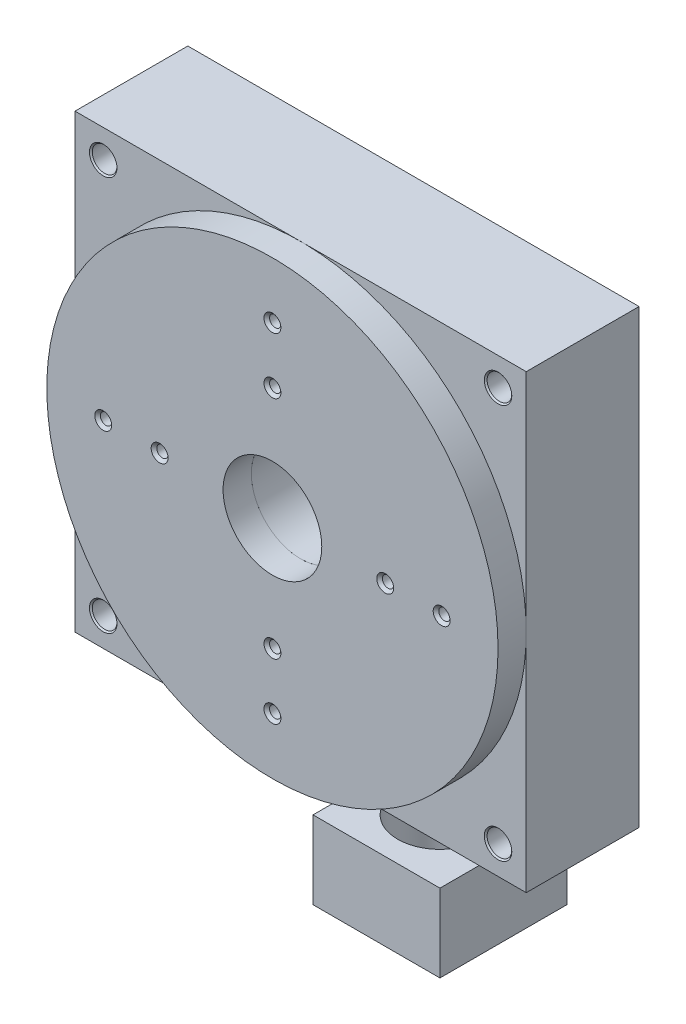
from build123d import *

# Parameters (mm, degrees)
SKETCH1_R                                     = 101.6
SKETCH1_R_2                                   = 22.225
BOSS_EXTRUDE1_DEPTH                           = 12.7
F_1_4_20_TAPPED_HOLE1_AT_2_COUNT              = 2
F_1_4_20_TAPPED_HOLE1_AT_2_PITCH              = 91.581002397
F_1_4_20_TAPPED_HOLE1_AT_3_COUNT              = 2
F_1_4_20_TAPPED_HOLE1_AT_3_PITCH              = 71.842048969
F_1_4_20_TAPPED_HOLE1_AT_4_COUNT              = 2
F_1_4_20_TAPPED_HOLE1_AT_4_PITCH              = 127
F_1_4_20_TAPPED_HOLE1_AT_5_COUNT              = 2
F_1_4_20_TAPPED_HOLE1_AT_5_PITCH              = 101.6
F_1_4_20_TAPPED_HOLE1_AT_6_COUNT              = 2
F_1_4_20_TAPPED_HOLE1_AT_6_PITCH              = 91.581002397
F_1_4_20_TAPPED_HOLE1_AT_7_COUNT              = 2
F_1_4_20_TAPPED_HOLE1_AT_7_PITCH              = 71.842048969
F_1_4_20_TAPPED_HOLE1_AT_8_COUNT              = 2
F_1_4_20_TAPPED_HOLE1_AT_8_PITCH              = 25.4
SKETCH4_W                                     = 203.2
SKETCH4_H                                     = 203.2
SKETCH4_R                                     = 22.225
BOSS_EXTRUDE2_DEPTH                           = 50.8
CBORE_FOR_1_4_SOCKET_HEAD_CAP_SCREW1_AT_COUNT = 2
CBORE_FOR_1_4_SOCKET_HEAD_CAP_SCREW1_AT_PITCH = 251.44717139
CBORE_FOR_1_4_SOCKET_HEAD_CAP_SCREW1_2_COUNT  = 2
CBORE_FOR_1_4_SOCKET_HEAD_CAP_SCREW1_2_PITCH  = 177.8
CBORE_FOR_1_4_SOCKET_HEAD_CAP_SCREW1_3_COUNT  = 2
CBORE_FOR_1_4_SOCKET_HEAD_CAP_SCREW1_3_PITCH  = 177.8
SKETCH7_W                                     = 57.15
SKETCH7_H                                     = 57.15
SKETCH7_R                                     = 19.05
BOSS_EXTRUDE3_DEPTH                           = 35.052
F_10_24_TAPPED_HOLE1_AT_2_COUNT               = 2
F_10_24_TAPPED_HOLE1_AT_2_PITCH               = 66.813105541
F_10_24_TAPPED_HOLE1_AT_3_COUNT               = 2
F_10_24_TAPPED_HOLE1_AT_3_PITCH               = 47.244
F_10_24_TAPPED_HOLE1_AT_4_COUNT               = 2
F_10_24_TAPPED_HOLE1_AT_4_PITCH               = 47.244


with BuildPart() as part:
    # Sketch1 → Boss-Extrude1 (new body)
    with BuildSketch(Plane.XY):
        Circle(SKETCH1_R)
        Circle(SKETCH1_R_2, mode=Mode.SUBTRACT)
    extrude(amount=BOSS_EXTRUDE1_DEPTH)

    # Sketch3 → 1/4-20 Tapped Hole1 (revolve, cut)
    with BuildSketch(Plane(origin=(-50.8, 0, 12.7), x_dir=(0, -1, 0), z_dir=(1, 0, 0))):
        Polygon((0, 0), (0, 12.7), (3.81, 12.7), (2.5527, 11.4427), (2.5527, 1.2573), (3.81, 0), align=None)
    f_1_4_20_tapped_hole1 = revolve(axis=Axis((-50.8, 0, 19.05), (0, 0, -1)), mode=Mode.SUBTRACT)

    # 1/4-20 Tapped Hole1 at 2: 1/4-20 Tapped Hole1 ×2
    with Locations(*[Vector(0.554700196225211, 0.8320502943378558, 0) * (i * F_1_4_20_TAPPED_HOLE1_AT_2_PITCH) for i in range(1, F_1_4_20_TAPPED_HOLE1_AT_2_COUNT)]):
        add(f_1_4_20_tapped_hole1, mode=Mode.SUBTRACT)

    # 1/4-20 Tapped Hole1 at 3: 1/4-20 Tapped Hole1 ×2
    with Locations(*[Vector(0.7071067811865276, 0.7071067811865674, 0) * (i * F_1_4_20_TAPPED_HOLE1_AT_3_PITCH) for i in range(1, F_1_4_20_TAPPED_HOLE1_AT_3_COUNT)]):
        add(f_1_4_20_tapped_hole1, mode=Mode.SUBTRACT)

    # 1/4-20 Tapped Hole1 at 4: 1/4-20 Tapped Hole1 ×2
    with Locations(*[(i * F_1_4_20_TAPPED_HOLE1_AT_4_PITCH, 0, 0) for i in range(1, F_1_4_20_TAPPED_HOLE1_AT_4_COUNT)]):
        add(f_1_4_20_tapped_hole1, mode=Mode.SUBTRACT)

    # 1/4-20 Tapped Hole1 at 5: 1/4-20 Tapped Hole1 ×2
    with Locations(*[(i * F_1_4_20_TAPPED_HOLE1_AT_5_PITCH, 0, 0) for i in range(1, F_1_4_20_TAPPED_HOLE1_AT_5_COUNT)]):
        add(f_1_4_20_tapped_hole1, mode=Mode.SUBTRACT)

    # 1/4-20 Tapped Hole1 at 6: 1/4-20 Tapped Hole1 ×2
    with Locations(*[Vector(0.5547001962252472, -0.8320502943378317, 0) * (i * F_1_4_20_TAPPED_HOLE1_AT_6_PITCH) for i in range(1, F_1_4_20_TAPPED_HOLE1_AT_6_COUNT)]):
        add(f_1_4_20_tapped_hole1, mode=Mode.SUBTRACT)

    # 1/4-20 Tapped Hole1 at 7: 1/4-20 Tapped Hole1 ×2
    with Locations(*[Vector(0.7071067811865674, -0.7071067811865276, 0) * (i * F_1_4_20_TAPPED_HOLE1_AT_7_PITCH) for i in range(1, F_1_4_20_TAPPED_HOLE1_AT_7_COUNT)]):
        add(f_1_4_20_tapped_hole1, mode=Mode.SUBTRACT)

    # 1/4-20 Tapped Hole1 at 8: 1/4-20 Tapped Hole1 ×2
    with Locations(*[(-i * F_1_4_20_TAPPED_HOLE1_AT_8_PITCH, 0, 0) for i in range(1, F_1_4_20_TAPPED_HOLE1_AT_8_COUNT)]):
        add(f_1_4_20_tapped_hole1, mode=Mode.SUBTRACT)


with BuildPart() as body_2:
    # Sketch4 → Boss-Extrude2 (new body)
    with BuildSketch(Plane(origin=(0, 0, 0), x_dir=(-1, 0, 0), z_dir=(0, 0, -1))):
        Rectangle(SKETCH4_W, SKETCH4_H)
        Circle(SKETCH4_R, mode=Mode.SUBTRACT)
    extrude(amount=BOSS_EXTRUDE2_DEPTH)

    # Sketch6 → CBORE for 1/4 Socket Head Cap Screw1 (revolve, cut)
    with BuildSketch(Plane(origin=(-88.9, -88.9, 0), x_dir=(0, -1, 0), z_dir=(1, 0, 0))):
        Polygon((0, 0), (0, 50.8), (3.8989, 50.8), (3.2639, 50.165), (3.2639, 44.45), (5.55625, 44.45), (5.55625, 0.635), (6.19125, 0), align=None)
    cbore_for_1_4_socket_head_cap_screw1 = revolve(axis=Axis((-88.9, -88.9, 6.35), (0, 0, -1)), mode=Mode.SUBTRACT)

    # CBORE for 1/4 Socket Head Cap Screw1 at: CBORE for 1/4 Socket Head Cap Screw1 ×2
    with Locations(*[Vector(0.7071067811865475, 0.7071067811865477, 0) * (i * CBORE_FOR_1_4_SOCKET_HEAD_CAP_SCREW1_AT_PITCH) for i in range(1, CBORE_FOR_1_4_SOCKET_HEAD_CAP_SCREW1_AT_COUNT)]):
        add(cbore_for_1_4_socket_head_cap_screw1, mode=Mode.SUBTRACT)

    # CBORE for 1_4 Socket Head Cap Screw1 2: CBORE for 1/4 Socket Head Cap Screw1 ×2
    with Locations(*[(i * CBORE_FOR_1_4_SOCKET_HEAD_CAP_SCREW1_2_PITCH, 0, 0) for i in range(1, CBORE_FOR_1_4_SOCKET_HEAD_CAP_SCREW1_2_COUNT)]):
        add(cbore_for_1_4_socket_head_cap_screw1, mode=Mode.SUBTRACT)

    # CBORE for 1_4 Socket Head Cap Screw1 3: CBORE for 1/4 Socket Head Cap Screw1 ×2
    with Locations(*[(0, i * CBORE_FOR_1_4_SOCKET_HEAD_CAP_SCREW1_3_PITCH, 0) for i in range(1, CBORE_FOR_1_4_SOCKET_HEAD_CAP_SCREW1_3_COUNT)]):
        add(cbore_for_1_4_socket_head_cap_screw1, mode=Mode.SUBTRACT)

    # Sketch7 → Boss-Extrude3 (add)
    with BuildSketch(Plane.XZ.offset(101.6)):
        with Locations((51.816, -10.922)):
            Rectangle(SKETCH7_W, SKETCH7_H)
        with Locations(Location((51.816, -10.922, 0), (0, 0, 34.982997869))):
            Circle(SKETCH7_R, mode=Mode.SUBTRACT)
    extrude(amount=BOSS_EXTRUDE3_DEPTH)

    # Sketch10 → #10-24 Tapped Hole1 (revolve, cut)
    with BuildSketch(Plane(origin=(28.194, -136.652, 12.7), x_dir=(0, 0, -1), z_dir=(1, 0, 0))):
        Polygon((0, 0), (0, 26.540824014), (1.89865, 25.4), (1.89865, 1.14935), (3.048, 0), align=None)
    f_10_24_tapped_hole1 = revolve(axis=Axis((28.194, -143.002, 12.7), (0, 1, 0)), mode=Mode.SUBTRACT)

    # #10-24 Tapped Hole1 at 2: #10-24 Tapped Hole1 ×2
    with Locations(*[Vector(0.7071067811865476, 0, -0.7071067811865475) * (i * F_10_24_TAPPED_HOLE1_AT_2_PITCH) for i in range(1, F_10_24_TAPPED_HOLE1_AT_2_COUNT)]):
        add(f_10_24_tapped_hole1, mode=Mode.SUBTRACT)

    # #10-24 Tapped Hole1 at 3: #10-24 Tapped Hole1 ×2
    with Locations(*[(i * F_10_24_TAPPED_HOLE1_AT_3_PITCH, 0, 0) for i in range(1, F_10_24_TAPPED_HOLE1_AT_3_COUNT)]):
        add(f_10_24_tapped_hole1, mode=Mode.SUBTRACT)

    # #10-24 Tapped Hole1 at 4: #10-24 Tapped Hole1 ×2
    with Locations(*[(0, 0, -i * F_10_24_TAPPED_HOLE1_AT_4_PITCH) for i in range(1, F_10_24_TAPPED_HOLE1_AT_4_COUNT)]):
        add(f_10_24_tapped_hole1, mode=Mode.SUBTRACT)


solid = Compound([part.part, body_2.part])
